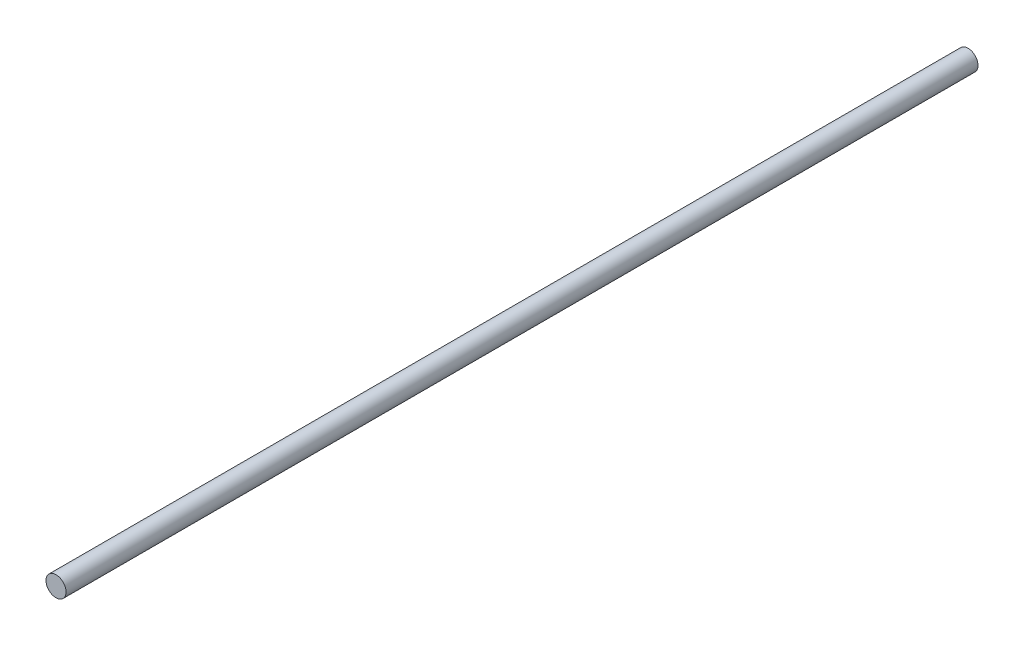
from build123d import *

# Parameters (mm, degrees)
ESQUISSE1_R      = 3
EXTRUSION1_DEPTH = 273


with BuildPart() as part:
    # Esquisse1 → Extrusion1 (new body)
    with BuildSketch(Plane.XY):
        Circle(ESQUISSE1_R)
    extrude(amount=EXTRUSION1_DEPTH)


solid = part.part
